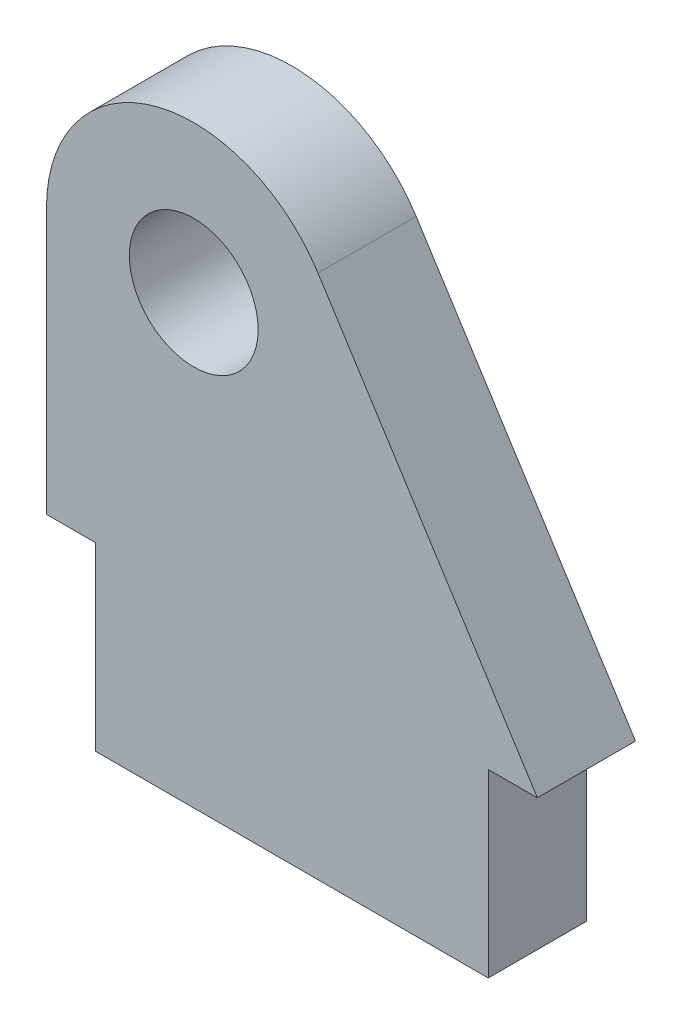
from build123d import *

# Parameters (mm, degrees)
SKETCH1_R           = 2.0828
BOSS_EXTRUDE1_DEPTH = 3.175


with BuildPart() as part:
    # Sketch1 → Boss-Extrude1 (new body)
    with BuildSketch(Plane.XY):
        with BuildLine():
            Line((7.9375, 2.921), (0.843056521, 14.070553816))
            ThreePointArc((0.843056521, 14.070553816), (-4.506430071, 16.086474021), (-7.9375, 11.5138708))
            Line((-7.9375, 11.5138708), (-7.9375, 2.921))
            Line((-7.9375, 2.921), (-6.35, 2.921))
            Line((-6.35, 2.921), (-6.35, -2.921))
            Line((-6.35, -2.921), (6.35, -2.921))
            Line((6.35, -2.921), (6.35, 2.921))
            Line((6.35, 2.921), (7.9375, 2.921))
        make_face()
        with Locations((-3.175, 11.5138708)):
            Circle(SKETCH1_R, mode=Mode.SUBTRACT)
    extrude(amount=BOSS_EXTRUDE1_DEPTH)


solid = part.part
